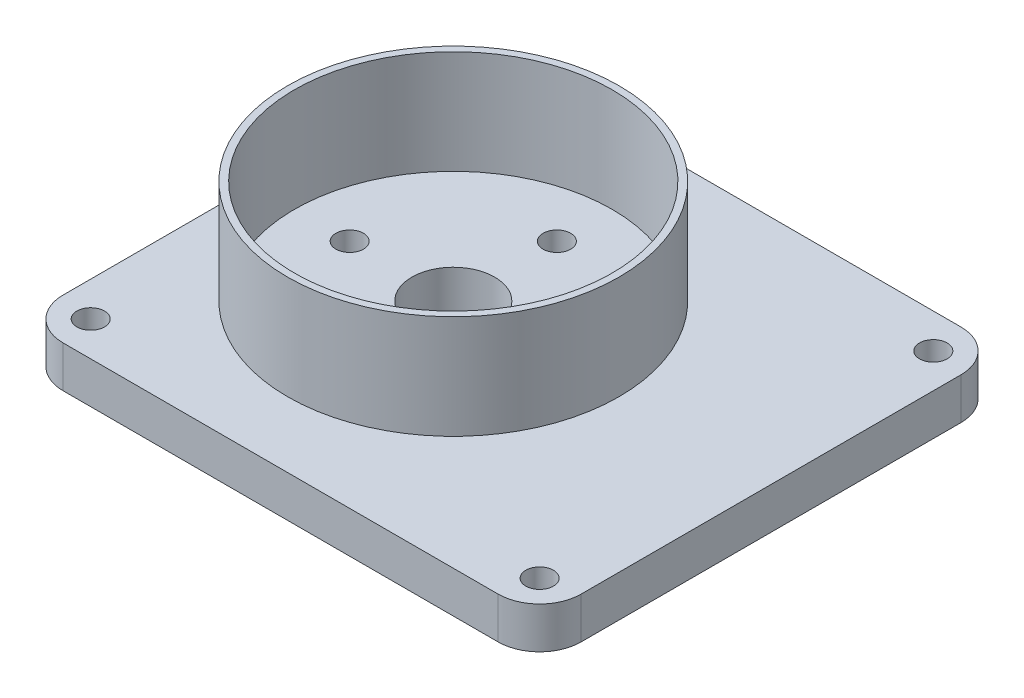
from build123d import *

# Parameters (mm, degrees)
SKETCH_1_W      = 37.5
SKETCH_1_H      = 33.5
SKETCH_1_R      = 3
SKETCH_1_R_2    = 1
EXTRUDE_1_DEPTH = 3
SKETCH_1_3_R    = 12
SKETCH_1_3_R_2  = 11.5
EXTRUDE_2_DEPTH = 10.5
FILLET_1_R      = 3


with BuildPart() as part:
    # 草图1 → 凸台-拉伸1 (new body)
    with BuildSketch(Plane(origin=(0, 0, 0), x_dir=(1, 0, 0), z_dir=(0, 1, 0))):
        Rectangle(SKETCH_1_W, SKETCH_1_H)
        with Locations((-4.25, 0)):
            Circle(SKETCH_1_R, mode=Mode.SUBTRACT)
        with Locations((-11.75, 0)):
            Circle(SKETCH_1_R_2, mode=Mode.SUBTRACT)
        with Locations((-4.25, 7.5)):
            Circle(SKETCH_1_R_2, mode=Mode.SUBTRACT)
        with Locations((3.25, 0)):
            Circle(SKETCH_1_R_2, mode=Mode.SUBTRACT)
        with Locations((-4.25, -7.5)):
            Circle(SKETCH_1_R_2, mode=Mode.SUBTRACT)
        with Locations((-16.25, 14.25)):
            Circle(SKETCH_1_R_2, mode=Mode.SUBTRACT)
        with Locations((-16.25, -14.25)):
            Circle(SKETCH_1_R_2, mode=Mode.SUBTRACT)
        with Locations((16.25, 14.25)):
            Circle(SKETCH_1_R_2, mode=Mode.SUBTRACT)
        with Locations((16.25, -14.25)):
            Circle(SKETCH_1_R_2, mode=Mode.SUBTRACT)
    extrude(amount=EXTRUDE_1_DEPTH)

    # 草图1<3> → 凸台-拉伸2 (add)
    with BuildSketch(Plane(origin=(0, 0, 0), x_dir=(1, 0, 0), z_dir=(0, 1, 0))):
        with Locations((-4.25, 0)):
            Circle(SKETCH_1_3_R)
        with Locations((-4.25, 0)):
            Circle(SKETCH_1_3_R_2, mode=Mode.SUBTRACT)
    extrude(amount=EXTRUDE_2_DEPTH)

    # 圆角1
    fillet_1_edges = [part.edges().sort_by_distance(p)[0] for p in [
        (-18.75, 1.5, 16.75),
        (18.75, 1.5, 16.75),
        (18.75, 1.5, -16.75),
        (-18.75, 1.5, -16.75),
    ]]
    fillet(fillet_1_edges, radius=FILLET_1_R)


solid = part.part
